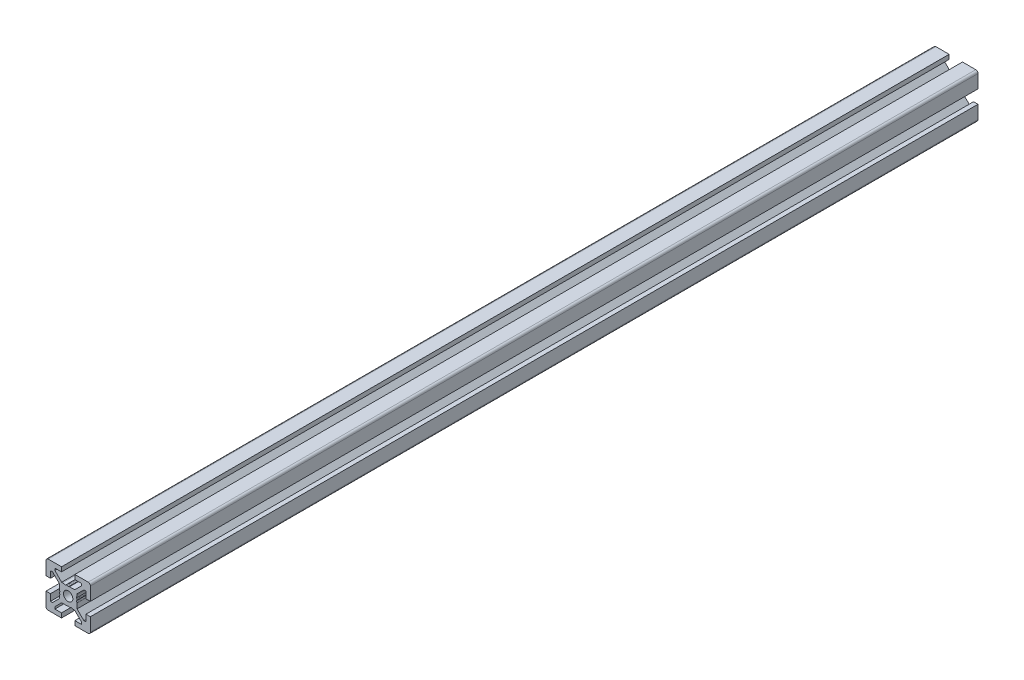
from build123d import *

# Parameters (mm, degrees)
SKETCH1_R           = 2.1
BOSS_EXTRUDE1_DEPTH = 400


with BuildPart() as part:
    # Sketch1 → Boss-Extrude1 (new body)
    with BuildSketch(Plane(origin=(0, 0, -2000), x_dir=(-1, 0, 0), z_dir=(0, 0, -1))):
        with BuildLine():
            Line((10, -3), (8, -3))
            Line((8, -3), (8, -6))
            Line((8, -6), (7.060660172, -6))
            Line((7.060660172, -6), (4, -2.939339828))
            Line((4, -2.939339828), (4, -2.5))
            Line((4, -2.5), (3.750976592, -1.218885629))
            Line((3.750976592, -1.218885629), (3.933012702, -0.903589838))
            ThreePointArc((3.933012702, -0.903589838), (4, -0.653589838), (3.933012702, -0.403589838))
            Line((3.933012702, -0.403589838), (3.7, 0))
            Line((3.7, 0), (3.933012702, 0.403589838))
            ThreePointArc((3.933012702, 0.403589838), (3.982962913, 0.524180316), (4, 0.653589838))
            Line((4, 0.653589838), (4, 2.939339828))
            Line((4, 2.939339828), (7.060660172, 6))
            Line((7.060660172, 6), (8, 6))
            Line((8, 6), (8, 3))
            Line((8, 3), (10, 3))
            Line((10, 3), (10, 9))
            ThreePointArc((10, 9), (9.707106781, 9.707106781), (9, 10))
            Line((9, 10), (3, 10))
            Line((3, 10), (3, 8))
            Line((3, 8), (6, 8))
            Line((6, 8), (6, 7.060660172))
            Line((6, 7.060660172), (2.939339828, 4))
            Line((2.939339828, 4), (2.5, 4))
            Line((2.5, 4), (1.218885629, 3.750976592))
            Line((1.218885629, 3.750976592), (0.903589838, 3.933012702))
            ThreePointArc((0.903589838, 3.933012702), (0.653589838, 4), (0.403589838, 3.933012702))
            Line((0.403589838, 3.933012702), (0, 3.7))
            Line((0, 3.7), (-0.403589838, 3.933012702))
            ThreePointArc((-0.403589838, 3.933012702), (-0.524180316, 3.982962913), (-0.653589838, 4))
            Line((-0.653589838, 4), (-2.939339828, 4))
            Line((-2.939339828, 4), (-6, 7.060660172))
            Line((-6, 7.060660172), (-6, 8))
            Line((-6, 8), (-3, 8))
            Line((-3, 8), (-3, 10))
            Line((-3, 10), (-9, 10))
            ThreePointArc((-9, 10), (-9.707106781, 9.707106781), (-10, 9))
            Line((-10, 9), (-10, 3))
            Line((-10, 3), (-8, 3))
            Line((-8, 3), (-8, 6))
            Line((-8, 6), (-7.060660172, 6))
            Line((-7.060660172, 6), (-4, 2.939339828))
            Line((-4, 2.939339828), (-4, 2.5))
            Line((-4, 2.5), (-3.750976592, 1.218885629))
            Line((-3.750976592, 1.218885629), (-3.933012702, 0.903589838))
            ThreePointArc((-3.933012702, 0.903589838), (-4, 0.653589838), (-3.933012702, 0.403589838))
            Line((-3.933012702, 0.403589838), (-3.7, 0))
            Line((-3.7, 0), (-3.933012702, -0.403589838))
            ThreePointArc((-3.933012702, -0.403589838), (-3.982962913, -0.524180316), (-4, -0.653589838))
            Line((-4, -0.653589838), (-4, -2.939339828))
            Line((-4, -2.939339828), (-7.060660172, -6))
            Line((-7.060660172, -6), (-8, -6))
            Line((-8, -6), (-8, -3))
            Line((-8, -3), (-10, -3))
            Line((-10, -3), (-10, -9))
            ThreePointArc((-10, -9), (-9.707106781, -9.707106781), (-9, -10))
            Line((-9, -10), (-3, -10))
            Line((-3, -10), (-3, -8))
            Line((-3, -8), (-6, -8))
            Line((-6, -8), (-6, -7.060660172))
            Line((-6, -7.060660172), (-2.939339828, -4))
            Line((-2.939339828, -4), (-2.5, -4))
            Line((-2.5, -4), (-1.218885629, -3.750976592))
            Line((-1.218885629, -3.750976592), (-0.903589838, -3.933012702))
            ThreePointArc((-0.903589838, -3.933012702), (-0.653589838, -4), (-0.403589838, -3.933012702))
            Line((-0.403589838, -3.933012702), (0, -3.7))
            Line((0, -3.7), (0.403589838, -3.933012702))
            ThreePointArc((0.403589838, -3.933012702), (0.524180316, -3.982962913), (0.653589838, -4))
            Line((0.653589838, -4), (2.939339828, -4))
            Line((2.939339828, -4), (6, -7.060660172))
            Line((6, -7.060660172), (6, -8))
            Line((6, -8), (3, -8))
            Line((3, -8), (3, -10))
            Line((3, -10), (9, -10))
            ThreePointArc((9, -10), (9.707106781, -9.707106781), (10, -9))
            Line((10, -9), (10, -3))
        make_face()
        with Locations(Location((0, 0, 0), (0, 0, 180))):
            Circle(SKETCH1_R, mode=Mode.SUBTRACT)
    extrude(amount=-BOSS_EXTRUDE1_DEPTH)


solid = part.part
